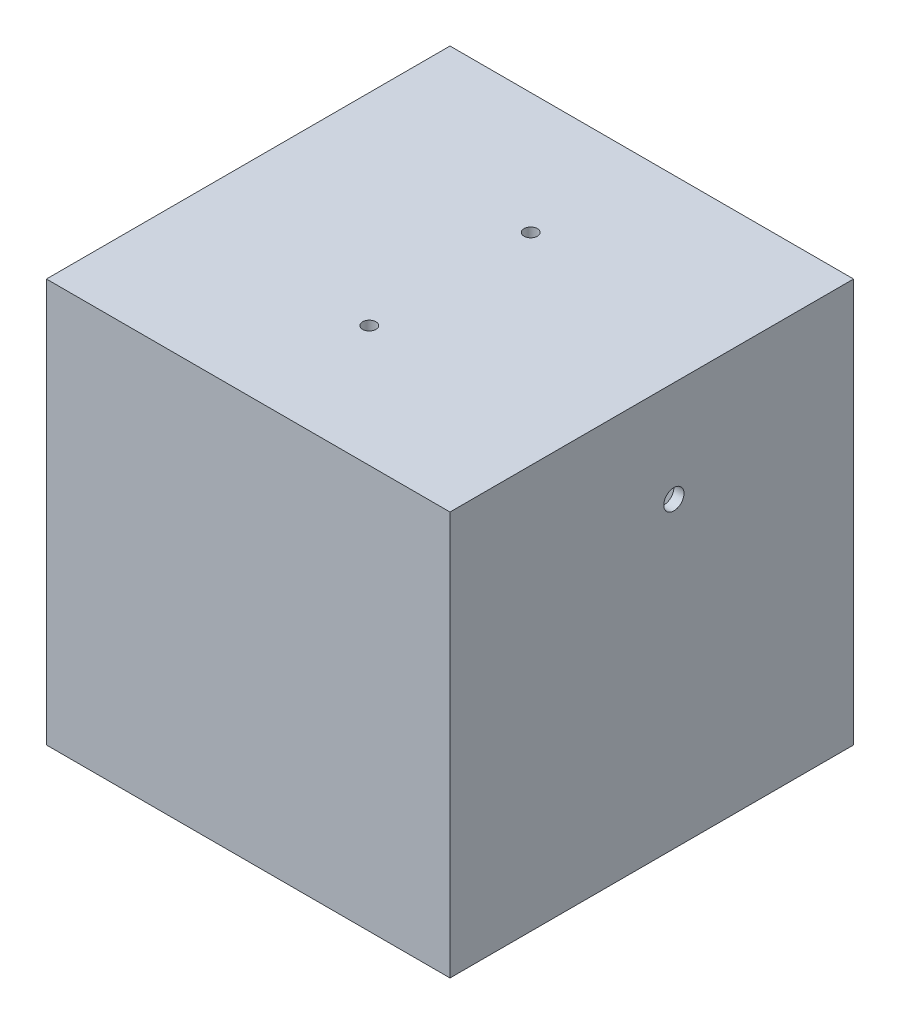
from build123d import *

# Parameters (mm, degrees)
SKETCH_1_W          = 200
SKETCH_1_H          = 200
EXTRUDE_1_DEPTH     = 5
SKETCH_3_W          = 200
SKETCH_3_H          = 200
SKETCH_3_W_2        = 190
SKETCH_3_H_2        = 190
EXTRUDE_2_DEPTH     = 190
SKETCH_4_W          = 200
SKETCH_4_H          = 200
SKETCH_4_R          = 70
EXTRUDE_3_DEPTH     = 5
SKETCH_5_R          = 3.3
CUT_EXTRUDE_1_DEPTH = 5
SKETCH_7_R          = 5
CUT_EXTRUDE_2_DEPTH = 344.547667726


with BuildPart() as part:
    # 草图1 → 凸台-拉伸1 (new body)
    with BuildSketch(Plane(origin=(0, 0, 0), x_dir=(1, 0, 0), z_dir=(0, 1, 0))):
        with Locations((100, 100)):
            Rectangle(SKETCH_1_W, SKETCH_1_H)
    extrude(amount=EXTRUDE_1_DEPTH)

    # 草图3 → 凸台-拉伸2 (add)
    with BuildSketch(Plane.XZ):
        with Locations((100, -100)):
            Rectangle(SKETCH_3_W, SKETCH_3_H)
        with Locations((100, -100)):
            Rectangle(SKETCH_3_W_2, SKETCH_3_H_2, mode=Mode.SUBTRACT)
    extrude(amount=EXTRUDE_2_DEPTH)

    # 草图4 → 凸台-拉伸3 (add)
    with BuildSketch(Plane.XZ.offset(190)):
        with Locations((100, -100)):
            Rectangle(SKETCH_4_W, SKETCH_4_H)
        with Locations(Location((100, -100, 0), (0, 0, 270))):
            Circle(SKETCH_4_R, mode=Mode.SUBTRACT)
    extrude(amount=EXTRUDE_3_DEPTH)

    # 草图5 → 切除-拉伸1 (cut)
    with BuildSketch(Plane(origin=(0, 5, 0), x_dir=(1, 0, 0), z_dir=(0, 1, 0))):
        with Locations(Location((100, 140, 0), (0, 0, 270))):
            Circle(SKETCH_5_R)
        with Locations(Location((100, 60, 0), (0, 0, 90))):
            Circle(SKETCH_5_R)
    extrude(amount=-CUT_EXTRUDE_1_DEPTH, mode=Mode.SUBTRACT)

    # 草图7 → 切除-拉伸2 (cut, through all)
    with BuildSketch(Plane(origin=(200, 0, 0), x_dir=(0, 0, -1), z_dir=(1, 0, 0))):
        with Locations((110.95, -45)):
            Circle(SKETCH_7_R)
    extrude(amount=-CUT_EXTRUDE_2_DEPTH, mode=Mode.SUBTRACT)


solid = part.part
